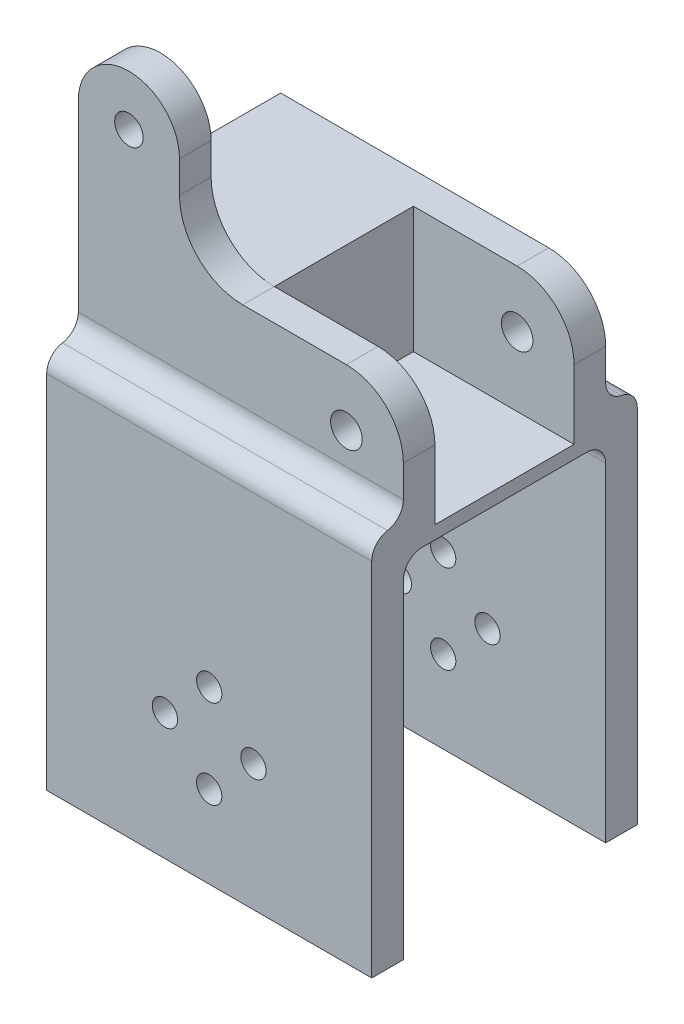
from build123d import *

# Parameters (mm, degrees)
SKETCH1_R              = 2.5
SKETCH1_R_2            = 2.25
BOSS_EXTRUDE1_DEPTH    = 16
CUT_EXTRUDE_START      = -27
CUT_EXTRUDE_4_DEPTH    = 27
EXTRUDE_1_DEPTH        = 55
EXTRUDE_1_DEPTH_BACK   = 5
SKETCH_8_W             = 51.4
SKETCH_8_H             = 5
EXTRUDE_1_2_DEPTH      = 55
EXTRUDE_1_2_DEPTH_BACK = 5
FILLET_1_R             = 3
FILLET_2_R             = 3
FILLET_3_R             = 3
FILLET_4_R             = 3
SKETCH_9_W             = 25.4
SKETCH_9_H             = 19.916079783
CUT_EXTRUDE_5_DEPTH    = 11
SKETCH_10_R            = 2
CUT_EXTRUDE_6_DEPTH    = 79.466808437


with BuildPart() as part:
    # Sketch1 → Boss-Extrude1 (new, symmetric)
    with BuildSketch(Plane.XY):
        with BuildLine():
            Line((-21.2, 33), (-21.2, 22))
            Line((-21.2, 22), (-21.2, 0))
            Line((-21.2, 0), (-21.2, -4))
            Line((-21.2, -4), (30.2, -4))
            Line((30.2, -4), (30.2, 9))
            ThreePointArc((30.2, 9), (27.563961031, 15.363961031), (21.2, 18))
            Line((21.2, 18), (4.8, 18))
            ThreePointArc((4.8, 18), (-2.271067812, 20.928932188), (-5.2, 28))
            Line((-5.2, 28), (-5.2, 33))
            ThreePointArc((-5.2, 33), (-13.2, 41), (-21.2, 33))
        make_face()
        with Locations((21.2, 9)):
            Circle(SKETCH1_R, mode=Mode.SUBTRACT)
        with Locations((-13.2, 33)):
            Circle(SKETCH1_R_2, mode=Mode.SUBTRACT)
    extrude(amount=BOSS_EXTRUDE1_DEPTH, both=True)

    # 草图7 → 切除-拉伸4 (cut)
    with BuildSketch(Plane(origin=(0, 0, -16), x_dir=(-1, 0, 0), z_dir=(0, 0, -1)).offset(CUT_EXTRUDE_START)):
        with BuildLine():
            Line((-4.8, 18), (21.2, 18))
            Line((21.2, 18), (21.2, 33))
            ThreePointArc((21.2, 33), (13.2, 41), (5.2, 33))
            Line((5.2, 33), (5.2, 28))
            ThreePointArc((5.2, 28), (2.271067812, 20.928932188), (-4.8, 18))
        make_face()
    extrude(amount=CUT_EXTRUDE_4_DEPTH, mode=Mode.SUBTRACT)


with BuildPart() as body_2:
    # 草图8 → 凸台-拉伸1 (new, two sides: drawn at the far end of the back side and taken through both)
    with BuildSketch(Plane.XZ.offset(4).offset(-EXTRUDE_1_DEPTH_BACK)):
        with Locations((4.5, 18.5)):
            Rectangle(SKETCH_8_W, SKETCH_8_H)
    extrude(amount=EXTRUDE_1_DEPTH + EXTRUDE_1_DEPTH_BACK)


with BuildPart() as body_3:
    # 草图8 → Extrude 1 2 (new, two sides: drawn at the far end of the back side and taken through both)
    with BuildSketch(Plane.XZ.offset(4).offset(-EXTRUDE_1_2_DEPTH_BACK)):
        with Locations((4.5, -18.5)):
            Rectangle(SKETCH_8_W, SKETCH_8_H)
    extrude(amount=EXTRUDE_1_2_DEPTH + EXTRUDE_1_2_DEPTH_BACK)

    # Combine 1: union part, body 2
    add(part.part)
    add(body_2.part)

    # 圆角1
    fillet_1_edges = [body_3.edges().sort_by_distance(p)[0] for p in [
        (4.5, 1, -16),
    ]]
    fillet(fillet_1_edges, radius=FILLET_1_R)

    # 圆角2
    fillet_2_edges = [body_3.edges().sort_by_distance(p)[0] for p in [
        (4.5, 1, 16),
    ]]
    fillet(fillet_2_edges, radius=FILLET_2_R)

    # 圆角3
    fillet_3_edges = [body_3.edges().sort_by_distance(p)[0] for p in [
        (4.5, -4, -16),
        (4.5, -4, 16),
    ]]
    fillet(fillet_3_edges, radius=FILLET_3_R)

    # 圆角4
    fillet_4_edges = [body_3.edges().sort_by_distance(p)[0] for p in [
        (4.5, 1, 21),
        (4.5, 1, -21),
    ]]
    fillet(fillet_4_edges, radius=FILLET_4_R)

    # 草图9 → 切除-拉伸5 (cut, symmetric)
    with BuildSketch(Plane.XY):
        with Locations((17.5, 8.041960108)):
            Rectangle(SKETCH_9_W, SKETCH_9_H)
    extrude(amount=CUT_EXTRUDE_5_DEPTH, both=True, mode=Mode.SUBTRACT)

    # 草图10 → 切除-拉伸6 (cut, through all)
    with BuildSketch(Plane(origin=(0, 0, -21), x_dir=(-1, 0, 0), z_dir=(0, 0, -1))):
        with Locations((2.5, -39)):
            Circle(SKETCH_10_R)
        with Locations((-4.5, -32)):
            Circle(SKETCH_10_R)
        with Locations((-4.5, -46)):
            Circle(SKETCH_10_R)
        with Locations((-11.5, -39)):
            Circle(SKETCH_10_R)
    extrude(amount=-CUT_EXTRUDE_6_DEPTH, mode=Mode.SUBTRACT)


solid = body_3.part
